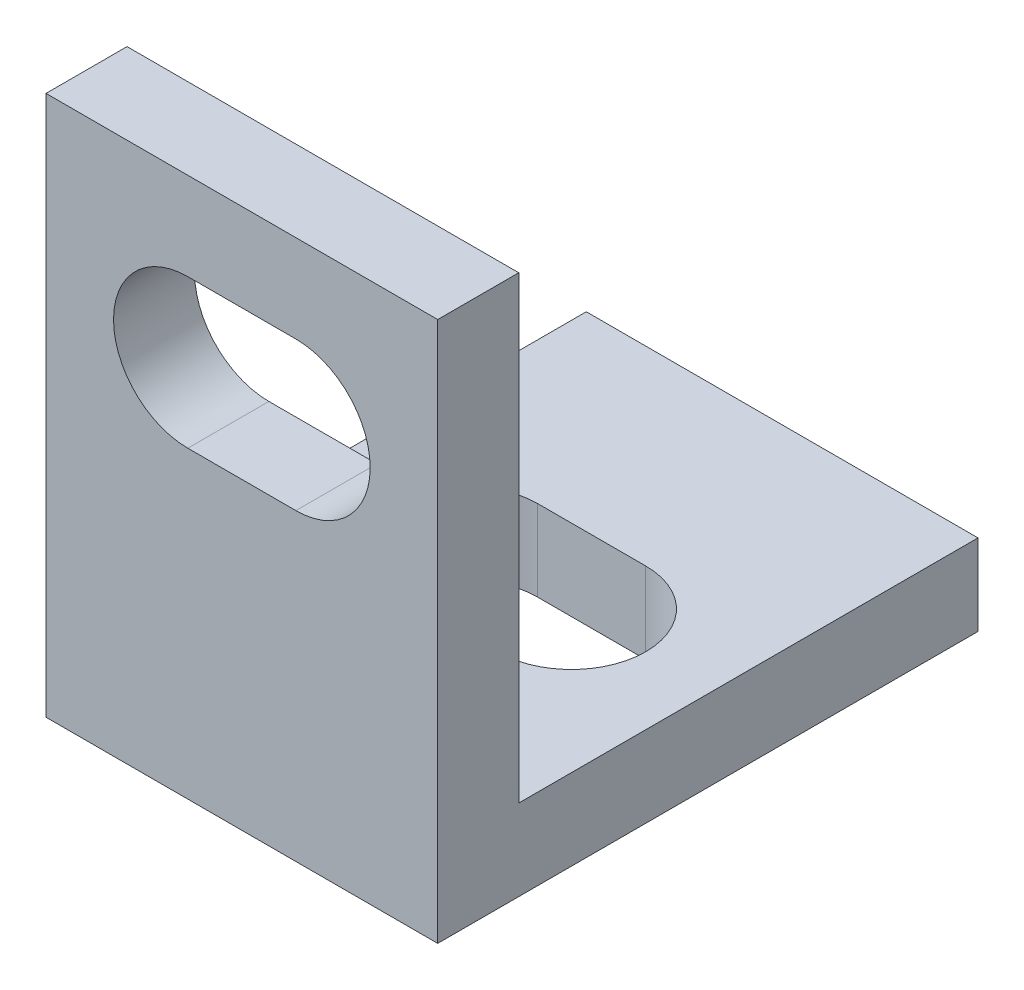
from build123d import *

# Parameters (mm, degrees)
BOSS_EXTRUDE1_DEPTH = 14.5
CUT_EXTRUDE1_DEPTH  = 32.784430151
CUT_EXTRUDE2_DEPTH  = 32.784430151


with BuildPart() as part:
    # Sketch1 → Boss-Extrude1 (new body)
    with BuildSketch(Plane(origin=(0, 0, 0), x_dir=(0, 0, -1), z_dir=(1, 0, 0))):
        Polygon((0, 0), (0, 20), (3, 20), (3, 3), (20, 3), (20, 0), align=None)
    extrude(amount=BOSS_EXTRUDE1_DEPTH)

    # Sketch2 → Cut-Extrude1 (cut, through all)
    with BuildSketch(Plane.XY):
        with BuildLine():
            Line((5.25, 16.75), (9.25, 16.75))
            ThreePointArc((9.25, 16.75), (12, 14), (9.25, 11.25))
            Line((9.25, 11.25), (5.25, 11.25))
            ThreePointArc((5.25, 11.25), (2.5, 14), (5.25, 16.75))
        make_face()
    extrude(amount=-CUT_EXTRUDE1_DEPTH, mode=Mode.SUBTRACT)

    # Sketch3 → Cut-Extrude2 (cut, through all)
    with BuildSketch(Plane.XZ):
        with BuildLine():
            Line((5.25, -7.45), (9.25, -7.45))
            ThreePointArc((9.25, -7.45), (12, -10.2), (9.25, -12.95))
            Line((9.25, -12.95), (5.25, -12.95))
            ThreePointArc((5.25, -12.95), (2.5, -10.2), (5.25, -7.45))
        make_face()
    extrude(amount=-CUT_EXTRUDE2_DEPTH, mode=Mode.SUBTRACT)


solid = part.part
